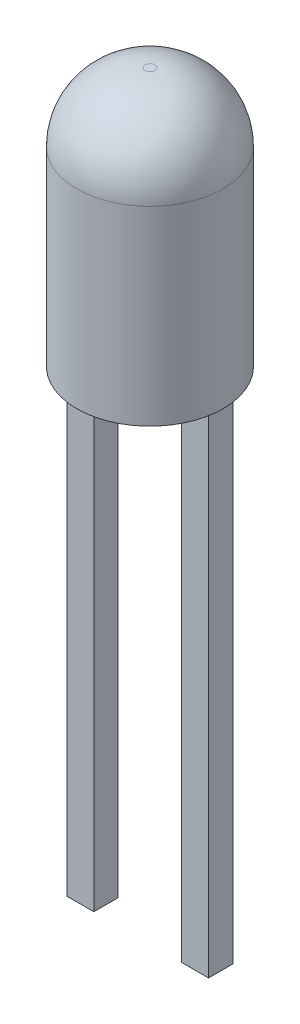
from build123d import *

# Parameters (mm, degrees)
SKETCH2_R                  = 1.5
BOSS_EXTRUDE1_DEPTH        = 5.3
FILLET1_R                  = 1.4
BOSS_EXTRUDE2_DEPTH        = 0.25
BOSS_EXTRUDE2_DEPTH_BACK   = 0.25
BOSS_EXTRUDE2_2_DEPTH      = 0.25
BOSS_EXTRUDE2_2_DEPTH_BACK = 0.25
SKETCH4_W                  = 0.55
SKETCH4_H                  = 0.5
BOSS_EXTRUDE3_DEPTH        = 10
BOSS_EXTRUDE3_2_DEPTH      = 10


with BuildPart() as part:
    # Sketch2 → Boss-Extrude1 (new body)
    with BuildSketch(Plane(origin=(0, 0, 0), x_dir=(1, 0, 0), z_dir=(0, 1, 0))):
        with Locations(Location((0, 0, 0), (0, 0, 270))):
            Circle(SKETCH2_R)
    extrude(amount=BOSS_EXTRUDE1_DEPTH)

    # Fillet1
    fillet1_edges = [part.edges().sort_by_distance(p)[0] for p in [
        (0, 5.3, -1.5),
    ]]
    fillet(fillet1_edges, radius=FILLET1_R)


with BuildPart() as body_2:
    # Sketch3 → Boss-Extrude2 (new, two sides: drawn at the far end of the back side and taken through both)
    with BuildSketch(Plane.XY.offset(-BOSS_EXTRUDE2_DEPTH_BACK)):
        Polygon((-1.45, 2.6), (-1.45, 0), (-0.9, 0), (-0.9, 0.6), (-0.624114196, 0.6), (-0.624114196, 0.82503781), (-1.225355096, 2.6), align=None)
    extrude(amount=BOSS_EXTRUDE2_DEPTH + BOSS_EXTRUDE2_DEPTH_BACK)


with BuildPart() as body_3:
    # Sketch3 → Boss-Extrude2 2 (new, two sides: drawn at the far end of the back side and taken through both)
    with BuildSketch(Plane.XY.offset(-BOSS_EXTRUDE2_2_DEPTH_BACK)):
        Polygon((1.45, 2.6), (-0.872452828, 2.6), (0.496677266, 0.6), (0.9, 0.6), (0.9, 0), (1.45, 0), align=None)
    extrude(amount=BOSS_EXTRUDE2_2_DEPTH + BOSS_EXTRUDE2_2_DEPTH_BACK)


with BuildPart() as body_4:
    # Sketch4 → Boss-Extrude3 (new body)
    with BuildSketch(Plane(origin=(0, 0, 0), x_dir=(-1, 0, 0), z_dir=(0, -1, 0))):
        with Locations((1.175, 0)):
            Rectangle(SKETCH4_W, SKETCH4_H)
    extrude(amount=BOSS_EXTRUDE3_DEPTH)


with BuildPart() as body_5:
    # Sketch4 → Boss-Extrude3 2 (new body)
    with BuildSketch(Plane(origin=(0, 0, 0), x_dir=(-1, 0, 0), z_dir=(0, -1, 0))):
        with Locations((-1.175, 0)):
            Rectangle(SKETCH4_W, SKETCH4_H)
    extrude(amount=BOSS_EXTRUDE3_2_DEPTH)


solid = Compound([part.part, body_2.part, body_3.part, body_4.part, body_5.part])
